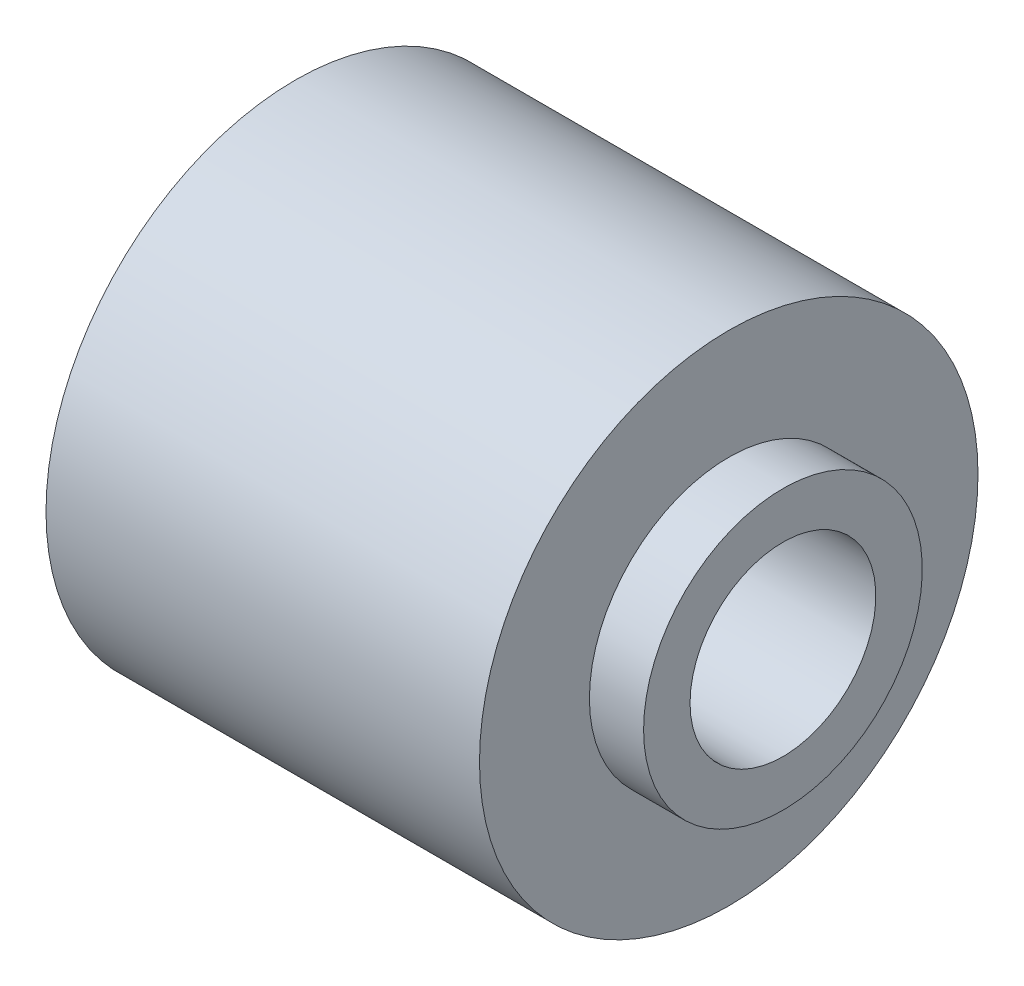
from build123d import *

# Parameters (mm, degrees)
SZKIC2_R                   = 6
WYTNIJ_WYCI_GNI_CIE1_DEPTH = 28


with BuildPart() as part:
    # Szkic1 → Obrót1 (revolve)
    with BuildSketch(Plane(origin=(0, 0, 0), x_dir=(1, 0, 0), z_dir=(0, 1, 0)), mode=Mode.PRIVATE) as obr_t1_sk:
        Polygon((-14, 6), (-17.5, 6), (-17.5, 9), (-14, 9), (-14, 16.1), (14, 16.1), (14, 9), (17.5, 9), (17.5, 6), (14, 6), (14, 0), (-14, 0), align=None)
    revolve(obr_t1_sk.sketch.rotate(Axis((-14, 0, 0), (1, 0, 0)), 180), axis=Axis((-14, 0, 0), (1, 0, 0)))

    # Szkic2 → Wytnij-wyciągnięcie1 (cut)
    with BuildSketch(Plane.ZY.offset(14)):
        Circle(SZKIC2_R)
    extrude(amount=-WYTNIJ_WYCI_GNI_CIE1_DEPTH, mode=Mode.SUBTRACT)


solid = part.part
